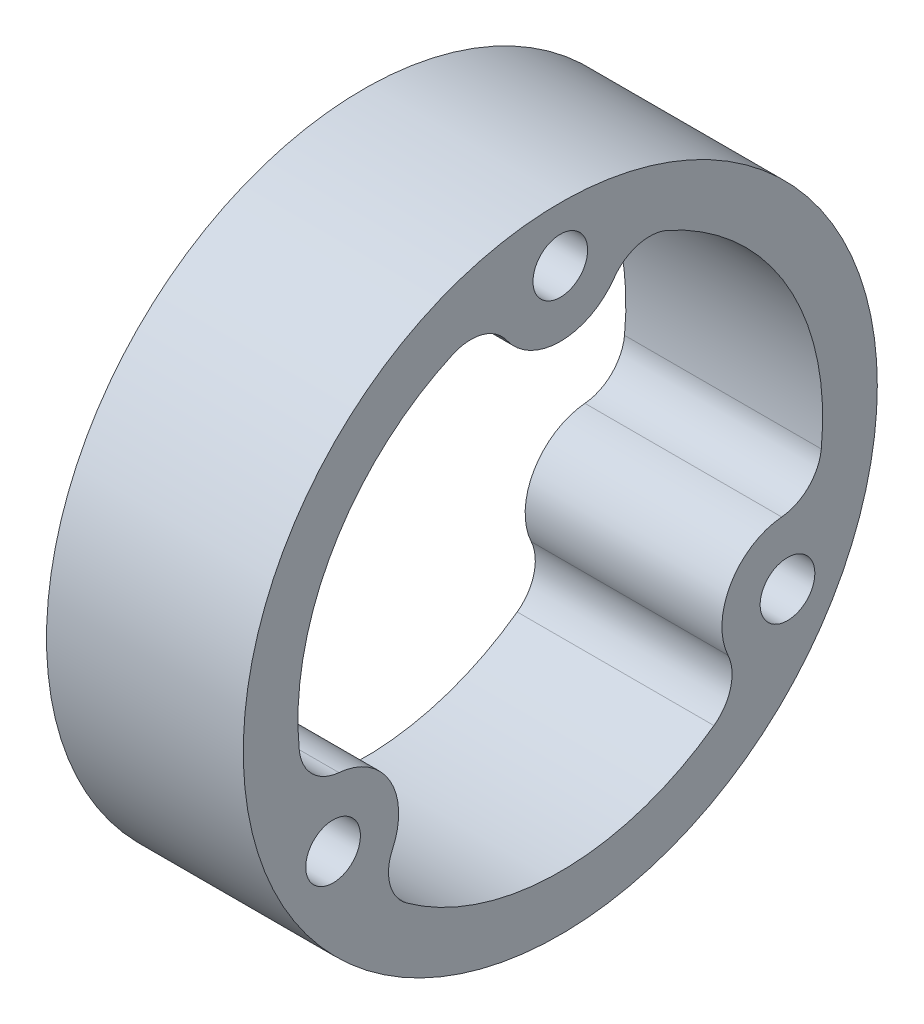
from build123d import *

# Parameters (mm, degrees)
SKETCH_1_R      = 14.5
SKETCH_1_R_2    = 1.25
EXTRUDE_1_DEPTH = 9
FILLET_1_R      = 2


with BuildPart() as part:
    # 草图1 → 凸台-拉伸1 (new body)
    with BuildSketch(Plane(origin=(0, 0, 0), x_dir=(0, 0, -1), z_dir=(1, 0, 0))):
        Circle(SKETCH_1_R)
        with Locations((0, 12)):
            Circle(SKETCH_1_R_2, mode=Mode.SUBTRACT)
        with Locations((10.392304845, -6)):
            Circle(SKETCH_1_R_2, mode=Mode.SUBTRACT)
        with Locations((-10.392304845, -6)):
            Circle(SKETCH_1_R_2, mode=Mode.SUBTRACT)
        with BuildLine():
            ThreePointArc((-2.976470225, 11.625), (-10.392304845, 6), (-11.555780431, -3.234801172))
            ThreePointArc((-11.555780431, -3.234801172), (-7.794228634, -4.5), (-8.579310207, -8.390198828))
            ThreePointArc((-8.579310207, -8.390198828), (0, -12), (8.579310207, -8.390198828))
            ThreePointArc((8.579310207, -8.390198828), (7.794228634, -4.5), (11.555780431, -3.234801172))
            ThreePointArc((11.555780431, -3.234801172), (10.392304845, 6), (2.976470225, 11.625))
            ThreePointArc((2.976470225, 11.625), (0, 9), (-2.976470225, 11.625))
        make_face(mode=Mode.SUBTRACT)
    extrude(amount=EXTRUDE_1_DEPTH)

    # 圆角1
    fillet_1_edges = [part.edges().sort_by_distance(p)[0] for p in [
        (4.5, -3.234801172, -11.555780431),
        (4.5, 11.625, -2.976470225),
        (4.5, 11.625, 2.976470225),
        (4.5, -3.234801172, 11.555780431),
        (4.5, -8.390198828, 8.579310207),
        (4.5, -8.390198828, -8.579310207),
    ]]
    fillet(fillet_1_edges, radius=FILLET_1_R)


solid = part.part
